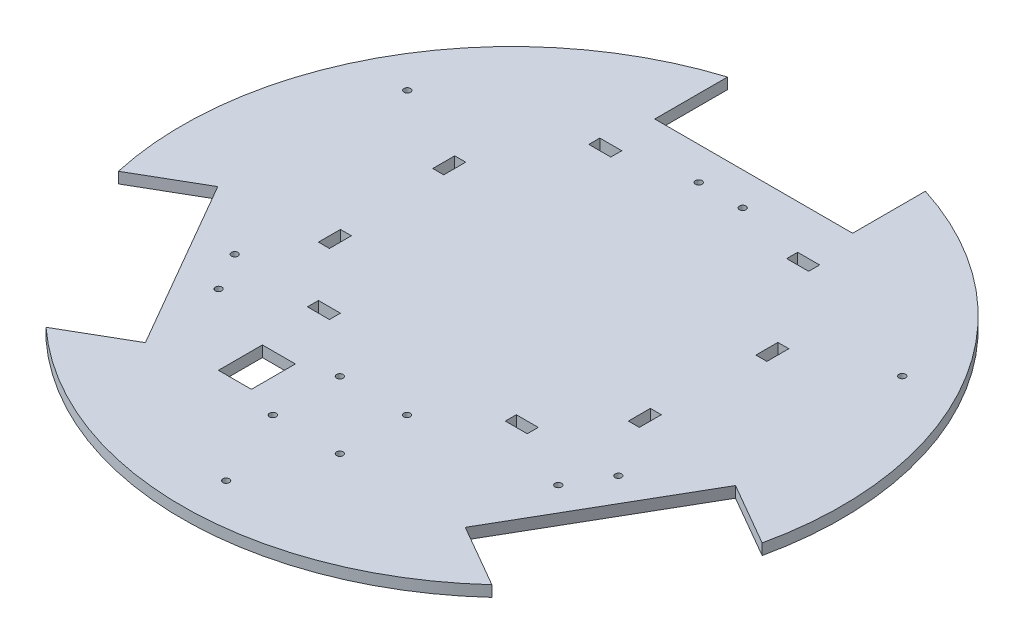
from build123d import *

# Parameters (mm, degrees)
BOSS_EXTRUDE1_DEPTH = 5
SKETCH2_R           = 1.5
CUT_EXTRUDE1_DEPTH  = 10
SKETCH3_W           = 10
SKETCH3_H           = 5
SKETCH3_W_2         = 5
SKETCH3_H_2         = 10
CUT_EXTRUDE2_DEPTH  = 10
SKETCH4_R           = 1.5
SKETCH4_W           = 15
SKETCH4_H           = 20
CUT_EXTRUDE3_DEPTH  = 10
SKETCH5_R           = 1.5
CUT_EXTRUDE4_DEPTH  = 10


with BuildPart() as part:
    # Sketch1 → Boss-Extrude1 (new body)
    with BuildSketch(Plane(origin=(0, 0, 0), x_dir=(1, 0, 0), z_dir=(0, 1, 0))):
        with BuildLine():
            Line((-45, 110), (45, 110))
            Line((45, 110), (45, 143.090880213))
            ThreePointArc((45, 143.090880213), (129.903810568, 75), (146.420337314, -32.574296936))
            Line((146.420337314, -32.574296936), (117.762794416, -16.02885683))
            Line((117.762794416, -16.02885683), (72.762794416, -93.97114317))
            Line((72.762794416, -93.97114317), (101.420337314, -110.516583277))
            ThreePointArc((101.420337314, -110.516583277), (0, -150), (-101.420337314, -110.516583277))
            Line((-101.420337314, -110.516583277), (-72.762794416, -93.97114317))
            Line((-72.762794416, -93.97114317), (-117.762794416, -16.02885683))
            Line((-117.762794416, -16.02885683), (-146.420337314, -32.574296936))
            ThreePointArc((-146.420337314, -32.574296936), (-129.903810568, 75), (-45, 143.090880213))
            Line((-45, 143.090880213), (-45, 110))
        make_face()
    extrude(amount=BOSS_EXTRUDE1_DEPTH)

    # Sketch2 → Cut-Extrude1 (cut)
    with BuildSketch(Plane(origin=(0, 5, 0), x_dir=(1, 0, 0), z_dir=(0, 1, 0))):
        with Locations(Location((-10, 95, 0), (0, 0, 270))):
            Circle(SKETCH2_R)
        with Locations(Location((10, 95, 0), (0, 0, 270))):
            Circle(SKETCH2_R)
        with Locations(Location((-87.27241336, -38.839745962, 0), (0, 0, 270))):
            Circle(SKETCH2_R)
        with Locations(Location((-77.27241336, -56.160254038, 0), (0, 0, 270))):
            Circle(SKETCH2_R)
        with Locations(Location((77.27241336, -56.160254038, 0), (0, 0, 270))):
            Circle(SKETCH2_R)
        with Locations(Location((87.27241336, -38.839745962, 0), (0, 0, 270))):
            Circle(SKETCH2_R)
    extrude(amount=-CUT_EXTRUDE1_DEPTH, mode=Mode.SUBTRACT)

    # Sketch3 → Cut-Extrude2 (cut)
    with BuildSketch(Plane(origin=(0, 5, 0), x_dir=(1, 0, 0), z_dir=(0, 1, 0))):
        with Locations((45, 87.5)):
            Rectangle(SKETCH3_W, SKETCH3_H)
        with Locations((-45, 87.5)):
            Rectangle(SKETCH3_W, SKETCH3_H)
        with Locations((-73.5, 45)):
            Rectangle(SKETCH3_W_2, SKETCH3_H_2)
        with Locations((73.5, 45)):
            Rectangle(SKETCH3_W_2, SKETCH3_H_2)
        with Locations((-45, -40.5)):
            Rectangle(SKETCH3_W, SKETCH3_H)
        with Locations((45, -40.5)):
            Rectangle(SKETCH3_W, SKETCH3_H)
        with Locations((-70.5, -10)):
            Rectangle(SKETCH3_W_2, SKETCH3_H_2)
        with Locations((70.5, -10)):
            Rectangle(SKETCH3_W_2, SKETCH3_H_2)
    extrude(amount=-CUT_EXTRUDE2_DEPTH, mode=Mode.SUBTRACT)

    # Sketch4 → Cut-Extrude3 (cut)
    with BuildSketch(Plane(origin=(0, 5, 0), x_dir=(1, 0, 0), z_dir=(0, 1, 0))):
        with Locations(Location((-15.25, -63, 0), (0, 0, 270))):
            Circle(SKETCH4_R)
        with Locations(Location((15.25, -63, 0), (0, 0, 270))):
            Circle(SKETCH4_R)
        with Locations(Location((-15.25, -93.5, 0), (0, 0, 270))):
            Circle(SKETCH4_R)
        with Locations(Location((15.25, -93.5, 0), (0, 0, 270))):
            Circle(SKETCH4_R)
        with Locations((-37.75, -78.25)):
            Rectangle(SKETCH4_W, SKETCH4_H)
    extrude(amount=-CUT_EXTRUDE3_DEPTH, mode=Mode.SUBTRACT)

    # Sketch5 → Cut-Extrude4 (cut)
    with BuildSketch(Plane(origin=(0, 5, 0), x_dir=(1, 0, 0), z_dir=(0, 1, 0))):
        with Locations(Location((-112.583302492, 65, 0), (0, 0, 270))):
            Circle(SKETCH5_R)
        with Locations(Location((112.583302492, 65, 0), (0, 0, 270))):
            Circle(SKETCH5_R)
        with Locations(Location((0, -130, 0), (0, 0, 270))):
            Circle(SKETCH5_R)
    extrude(amount=-CUT_EXTRUDE4_DEPTH, mode=Mode.SUBTRACT)


solid = part.part
